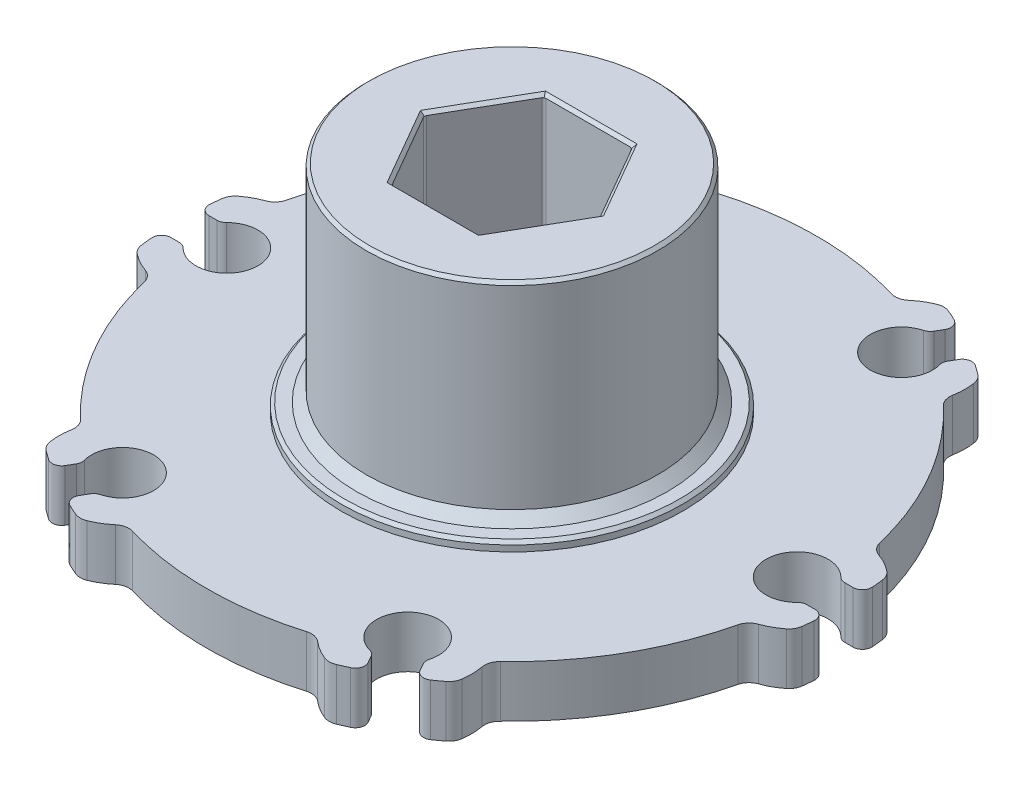
from build123d import *

# Parameters (mm, degrees)
SKETCH1_W           = 27.7876
SKETCH1_H           = 4.318
CUT_EXTRUDE1_DEPTH  = 40.534118828
CUT_EXTRUDE2_DEPTH  = 40.534118828
CUT_EXTRUDE3_DEPTH  = 40.534118828
CUT_EXTRUDE4_DEPTH  = 40.534118828
CUT_EXTRUDE5_DEPTH  = 40.534118828
CUT_EXTRUDE6_DEPTH  = 40.534118828
CUT_EXTRUDE7_DEPTH  = 40.534118828
CUT_EXTRUDE8_DEPTH  = 40.502232788
CUT_EXTRUDE9_DEPTH  = 40.502232788
CUT_EXTRUDE10_DEPTH = 40.502232788
CUT_EXTRUDE11_DEPTH = 39.097241392
CUT_EXTRUDE12_DEPTH = 39.097241392
SKETCH14_R          = 14.2748
BOSS_EXTRUDE1_DEPTH = 1.524
SKETCH15_R          = 9.23823544
BOSS_EXTRUDE2_DEPTH = 1.524
BOSS_EXTRUDE3_START = 0.762
SKETCH16_R          = 14.2748
BOSS_EXTRUDE3_DEPTH = 0.762
SKETCH17_R          = 12.1666
BOSS_EXTRUDE4_DEPTH = 17.272
CUT_EXTRUDE13_DEPTH = 46.584149412
SKETCH19_W          = 2.5908
SKETCH19_H          = 4.318
SKETCH20_W          = 2.5908
SKETCH20_H          = 4.318
SKETCH21_W          = 2.5908
SKETCH21_H          = 4.318
SKETCH22_W          = 2.5908
SKETCH22_H          = 4.318
SKETCH23_W          = 2.5908
SKETCH23_H          = 4.318
SKETCH24_W          = 2.5908
SKETCH24_H          = 4.318
CHAMFER1_SIZE       = 0.254
CHAMFER2_SIZE       = 0.8128
FILLET1_R           = 0.254
FILLET2_R           = 0.7874
FILLET3_R           = 1.27


with BuildPart() as part:
    # Sketch1 → Revolve1 (revolve)
    with BuildSketch(Plane.XY, mode=Mode.PRIVATE) as revolve1_sk:
        with Locations((13.8938, 5.207)):
            Rectangle(SKETCH1_W, SKETCH1_H)
    revolve(revolve1_sk.sketch.rotate(Axis((0, 7.366, 0), (0, -1, 0)), 270), axis=Axis((0, 7.366, 0), (0, -1, 0)))

    # Sketch2 → Cut-Extrude1 (cut, through all)
    with BuildSketch(Plane(origin=(0, 7.366, 0), x_dir=(-1, 0, 0), z_dir=(0, 1, 0))):
        with BuildLine():
            Line((27.742216161, 1.5875), (25.859959008, 1.5875))
            ThreePointArc((25.859959008, 1.5875), (26.4033, 0), (25.859959008, -1.5875))
            Line((25.859959008, -1.5875), (27.742216161, -1.5875))
            ThreePointArc((27.742216161, -1.5875), (27.7876, 0), (27.742216161, 1.5875))
        make_face()
    extrude(amount=-CUT_EXTRUDE1_DEPTH, mode=Mode.SUBTRACT)

    # Sketch3 → Cut-Extrude2 (cut, through all)
    with BuildSketch(Plane(origin=(0, 7.366, 0), x_dir=(-1, 0, 0), z_dir=(0, 1, 0))):
        with BuildLine():
            ThreePointArc((27.521980347, -3.832924674), (26.332306318, -4.701290474), (24.95050128, -5.211190755))
            ThreePointArc((24.95050128, -5.211190755), (22.074034915, -12.74445), (16.988274218, -19.002172568))
            ThreePointArc((16.988274218, -19.002172568), (17.23759014, -20.453800974), (17.080400312, -21.918271806))
            ThreePointArc((17.080400312, -21.918271806), (24.06476751, -13.8938), (27.521980347, -3.832924674))
        make_face()
    extrude(amount=-CUT_EXTRUDE2_DEPTH, mode=Mode.SUBTRACT)

    # Sketch4 → Cut-Extrude3 (cut, through all)
    with BuildSketch(Plane(origin=(0, 7.366, 0), x_dir=(-1, 0, 0), z_dir=(0, 1, 0))):
        with BuildLine():
            Line((15.245923409, -23.231713952), (14.304794833, -21.601631442))
            ThreePointArc((14.304794833, -21.601631442), (13.20165, -22.865928544), (11.555164176, -23.189131442))
            Line((11.555164176, -23.189131442), (12.496292752, -24.819213952))
            ThreePointArc((12.496292752, -24.819213952), (13.8938, -24.06476751), (15.245923409, -23.231713952))
        make_face()
    extrude(amount=-CUT_EXTRUDE3_DEPTH, mode=Mode.SUBTRACT)

    # Sketch5 → Cut-Extrude4 (cut, through all)
    with BuildSketch(Plane(origin=(0, 7.366, 0), x_dir=(-1, 0, 0), z_dir=(0, 1, 0))):
        with BuildLine():
            ThreePointArc((10.441580035, -25.75119648), (9.094716178, -25.155091448), (7.962227062, -24.213363323))
            ThreePointArc((7.962227062, -24.213363323), (0, -25.4889), (-7.962227062, -24.213363323))
            ThreePointArc((-7.962227062, -24.213363323), (-9.094716178, -25.155091448), (-10.441580035, -25.75119648))
            ThreePointArc((-10.441580035, -25.75119648), (0, -27.7876), (10.441580035, -25.75119648))
        make_face()
    extrude(amount=-CUT_EXTRUDE4_DEPTH, mode=Mode.SUBTRACT)

    # Sketch6 → Cut-Extrude5 (cut, through all)
    with BuildSketch(Plane(origin=(0, 7.366, 0), x_dir=(-1, 0, 0), z_dir=(0, 1, 0))):
        with BuildLine():
            Line((-12.496292752, -24.819213952), (-11.555164176, -23.189131442))
            ThreePointArc((-11.555164176, -23.189131442), (-13.20165, -22.865928544), (-14.304794833, -21.601631442))
            Line((-14.304794833, -21.601631442), (-15.245923409, -23.231713952))
            ThreePointArc((-15.245923409, -23.231713952), (-13.8938, -24.06476751), (-12.496292752, -24.819213952))
        make_face()
    extrude(amount=-CUT_EXTRUDE5_DEPTH, mode=Mode.SUBTRACT)

    # Sketch7 → Cut-Extrude6 (cut, through all)
    with BuildSketch(Plane(origin=(0, 7.366, 0), x_dir=(-1, 0, 0), z_dir=(0, 1, 0))):
        with BuildLine():
            ThreePointArc((-17.080400312, -21.918271806), (-17.23759014, -20.453800974), (-16.988274218, -19.002172568))
            ThreePointArc((-16.988274218, -19.002172568), (-22.074034915, -12.74445), (-24.95050128, -5.211190755))
            ThreePointArc((-24.95050128, -5.211190755), (-26.332306318, -4.701290474), (-27.521980347, -3.832924674))
            ThreePointArc((-27.521980347, -3.832924674), (-24.06476751, -13.8938), (-17.080400312, -21.918271806))
        make_face()
    extrude(amount=-CUT_EXTRUDE6_DEPTH, mode=Mode.SUBTRACT)

    # Sketch8 → Cut-Extrude7 (cut, through all)
    with BuildSketch(Plane(origin=(0, 7.366, 0), x_dir=(-1, 0, 0), z_dir=(0, 1, 0))):
        with BuildLine():
            Line((-27.742216161, -1.5875), (-25.859959008, -1.5875))
            ThreePointArc((-25.859959008, -1.5875), (-26.4033, 0), (-25.859959008, 1.5875))
            Line((-25.859959008, 1.5875), (-27.742216161, 1.5875))
            ThreePointArc((-27.742216161, 1.5875), (-27.7876, 0), (-27.742216161, -1.5875))
        make_face()
    extrude(amount=-CUT_EXTRUDE7_DEPTH, mode=Mode.SUBTRACT)

    # Sketch9 → Cut-Extrude8 (cut, through all)
    with BuildSketch(Plane(origin=(0, 7.366, 0), x_dir=(-1, 0, 0), z_dir=(0, 1, 0))):
        with BuildLine():
            ThreePointArc((-27.521980347, 3.832924674), (-26.332306318, 4.701290474), (-24.95050128, 5.211190755))
            ThreePointArc((-24.95050128, 5.211190755), (-22.074034915, 12.74445), (-16.988274218, 19.002172568))
            ThreePointArc((-16.988274218, 19.002172568), (-17.23759014, 20.453800974), (-17.080400312, 21.918271806))
            ThreePointArc((-17.080400312, 21.918271806), (-24.06476751, 13.8938), (-27.521980347, 3.832924674))
        make_face()
    extrude(amount=-CUT_EXTRUDE8_DEPTH, mode=Mode.SUBTRACT)

    # Sketch10 → Cut-Extrude9 (cut, through all)
    with BuildSketch(Plane(origin=(0, 7.366, 0), x_dir=(-1, 0, 0), z_dir=(0, 1, 0))):
        with BuildLine():
            Line((-15.245923409, 23.231713952), (-14.304794833, 21.601631442))
            ThreePointArc((-14.304794833, 21.601631442), (-13.20165, 22.865928544), (-11.555164176, 23.189131442))
            Line((-11.555164176, 23.189131442), (-12.496292752, 24.819213952))
            ThreePointArc((-12.496292752, 24.819213952), (-13.8938, 24.06476751), (-15.245923409, 23.231713952))
        make_face()
    extrude(amount=-CUT_EXTRUDE9_DEPTH, mode=Mode.SUBTRACT)

    # Sketch11 → Cut-Extrude10 (cut, through all)
    with BuildSketch(Plane(origin=(0, 7.366, 0), x_dir=(-1, 0, 0), z_dir=(0, 1, 0))):
        with BuildLine():
            ThreePointArc((-10.441580035, 25.75119648), (-9.094716178, 25.155091448), (-7.962227062, 24.213363323))
            ThreePointArc((-7.962227062, 24.213363323), (0, 25.4889), (7.962227062, 24.213363323))
            ThreePointArc((7.962227062, 24.213363323), (9.094716178, 25.155091448), (10.441580035, 25.75119648))
            ThreePointArc((10.441580035, 25.75119648), (0, 27.7876), (-10.441580035, 25.75119648))
        make_face()
    extrude(amount=-CUT_EXTRUDE10_DEPTH, mode=Mode.SUBTRACT)

    # Sketch12 → Cut-Extrude11 (cut, through all)
    with BuildSketch(Plane(origin=(0, 7.366, 0), x_dir=(-1, 0, 0), z_dir=(0, 1, 0))):
        with BuildLine():
            Line((12.496292752, 24.819213952), (11.555164176, 23.189131442))
            ThreePointArc((11.555164176, 23.189131442), (13.20165, 22.865928544), (14.304794833, 21.601631442))
            Line((14.304794833, 21.601631442), (15.245923409, 23.231713952))
            ThreePointArc((15.245923409, 23.231713952), (13.8938, 24.06476751), (12.496292752, 24.819213952))
        make_face()
    extrude(amount=-CUT_EXTRUDE11_DEPTH, mode=Mode.SUBTRACT)

    # Sketch13 → Cut-Extrude12 (cut, through all)
    with BuildSketch(Plane(origin=(0, 7.366, 0), x_dir=(-1, 0, 0), z_dir=(0, 1, 0))):
        with BuildLine():
            ThreePointArc((17.080400312, 21.918271806), (17.23759014, 20.453800974), (16.988274218, 19.002172568))
            ThreePointArc((16.988274218, 19.002172568), (22.074034915, 12.74445), (24.95050128, 5.211190755))
            ThreePointArc((24.95050128, 5.211190755), (26.332306318, 4.701290474), (27.521980347, 3.832924674))
            ThreePointArc((27.521980347, 3.832924674), (24.06476751, 13.8938), (17.080400312, 21.918271806))
        make_face()
    extrude(amount=-CUT_EXTRUDE12_DEPTH, mode=Mode.SUBTRACT)

    # Sketch14 → Boss-Extrude1 (add)
    with BuildSketch(Plane.XZ.offset(-3.048)):
        with Locations(Location((0, 0, 0), (0, 0, 270))):
            Circle(SKETCH14_R)
    extrude(amount=BOSS_EXTRUDE1_DEPTH)

    # Sketch15 → Boss-Extrude2 (add)
    with BuildSketch(Plane.XZ.offset(-1.524)):
        with Locations(Location((0, 0, 0), (0, 0, 270))):
            Circle(SKETCH15_R)
    extrude(amount=BOSS_EXTRUDE2_DEPTH)

    # Sketch16 → Boss-Extrude3 (add)
    with BuildSketch(Plane(origin=(0, 7.366, 0), x_dir=(-1, 0, 0), z_dir=(0, 1, 0)).offset(BOSS_EXTRUDE3_START)):
        with Locations(Location((0, 0, 0), (0, 0, 270))):
            Circle(SKETCH16_R)
    extrude(amount=-BOSS_EXTRUDE3_DEPTH)

    # Sketch17 → Boss-Extrude4 (add)
    with BuildSketch(Plane(origin=(0, 8.128, 0), x_dir=(-1, 0, 0), z_dir=(0, 1, 0))):
        with Locations(Location((0, 0, 0), (0, 0, 90))):
            Circle(SKETCH17_R)
    extrude(amount=BOSS_EXTRUDE4_DEPTH)

    # Sketch18 → Cut-Extrude13 (cut, through all)
    with BuildSketch(Plane(origin=(0, 25.4, 0), x_dir=(-1, 0, 0), z_dir=(0, 1, 0))):
        Polygon((-3.673506558, -6.3627), (3.673506558, -6.3627), (7.347013116, 0), (3.673506558, 6.3627), (-3.673506558, 6.3627), (-7.347013116, 0), align=None)
    extrude(amount=-CUT_EXTRUDE13_DEPTH, mode=Mode.SUBTRACT)

    # Sketch19 → Cut-Revolve1 (revolve, cut)
    with BuildSketch(Plane(origin=(0, 0, 0), x_dir=(-1, 0, 0), z_dir=(0, 0, -1))):
        with Locations((22.5171, 5.207)):
            Rectangle(SKETCH19_W, SKETCH19_H)
    revolve(axis=Axis((-23.8125, 3.048, 0), (0, 1, 0)), mode=Mode.SUBTRACT)

    # Sketch20 → Cut-Revolve2 (revolve, cut)
    with BuildSketch(Plane(origin=(0, 0, -20.622229928), x_dir=(-1, 0, 0), z_dir=(0, 0, -1))):
        with Locations((10.61085, 5.207)):
            Rectangle(SKETCH20_W, SKETCH20_H)
    revolve(axis=Axis((-11.90625, 3.048, -20.622229928), (0, 1, 0)), mode=Mode.SUBTRACT)

    # Sketch21 → Cut-Revolve3 (revolve, cut)
    with BuildSketch(Plane(origin=(0, 0, -20.622229928), x_dir=(-1, 0, 0), z_dir=(0, 0, -1))):
        with Locations((-13.20165, 5.207)):
            Rectangle(SKETCH21_W, SKETCH21_H)
    revolve(axis=Axis((11.90625, 3.048, -20.622229928), (0, 1, 0)), mode=Mode.SUBTRACT)

    # Sketch22 → Cut-Revolve4 (revolve, cut)
    with BuildSketch(Plane(origin=(0, 0, 0), x_dir=(-1, 0, 0), z_dir=(0, 0, -1))):
        with Locations((-25.1079, 5.207)):
            Rectangle(SKETCH22_W, SKETCH22_H)
    revolve(axis=Axis((23.8125, 3.048, 0), (0, 1, 0)), mode=Mode.SUBTRACT)

    # Sketch23 → Cut-Revolve5 (revolve, cut)
    with BuildSketch(Plane(origin=(0, 0, 20.622229928), x_dir=(-1, 0, 0), z_dir=(0, 0, -1))):
        with Locations((-13.20165, 5.207)):
            Rectangle(SKETCH23_W, SKETCH23_H)
    revolve(axis=Axis((11.90625, 3.048, 20.622229928), (0, 1, 0)), mode=Mode.SUBTRACT)

    # Sketch24 → Cut-Revolve6 (revolve, cut)
    with BuildSketch(Plane(origin=(0, 0, 20.622229928), x_dir=(-1, 0, 0), z_dir=(0, 0, -1))):
        with Locations((10.61085, 5.207)):
            Rectangle(SKETCH24_W, SKETCH24_H)
    revolve(axis=Axis((-11.90625, 3.048, 20.622229928), (0, 1, 0)), mode=Mode.SUBTRACT)

    # Chamfer1
    chamfer1_edges = [part.edges().sort_by_distance(p)[0] for p in [
        (0, 1.524, 14.2748),
        (0, 0, 9.23823544),
        (0, 8.128, 14.2748),
        (0, 25.4, -12.1666),
        (5.510259837, 0, -3.18135),
        (5.510259837, 0, 3.18135),
        (0, 0, 6.3627),
        (-5.510259837, 0, 3.18135),
        (-5.510259837, 0, -3.18135),
        (0, 0, -6.3627),
        (5.510259837, 25.4, -3.18135),
        (0, 25.4, -6.3627),
        (-5.510259837, 25.4, -3.18135),
        (-5.510259837, 25.4, 3.18135),
        (0, 25.4, 6.3627),
        (5.510259837, 25.4, 3.18135),
    ]]
    chamfer(chamfer1_edges, length=CHAMFER1_SIZE)

    # Chamfer2
    chamfer2_edges = [part.edges().sort_by_distance(p)[0] for p in [
        (0, 8.128, -12.1666),
    ]]
    chamfer(chamfer2_edges, length=CHAMFER2_SIZE)

    # Fillet1
    fillet1_edges = [part.edges().sort_by_distance(p)[0] for p in [
        (3.673506558, 12.7, -6.3627),
        (7.347013116, 12.7, 0),
        (-3.673506558, 12.7, -6.3627),
        (-7.347013116, 12.7, 0),
        (-3.673506558, 12.7, 6.3627),
        (3.673506558, 12.7, 6.3627),
    ]]
    fillet(fillet1_edges, radius=FILLET1_R)

    # Fillet2
    fillet2_edges = [part.edges().sort_by_distance(p)[0] for p in [
        (27.742216161, 5.207, -1.5875),
        (27.742216161, 5.207, 1.5875),
        (25.859959008, 5.207, 1.5875),
        (25.859959008, 5.207, -1.5875),
        (-27.742216161, 5.207, 1.5875),
        (-27.742216161, 5.207, -1.5875),
        (-25.859959008, 5.207, -1.5875),
        (-25.859959008, 5.207, 1.5875),
        (15.245923409, 5.207, 23.231713952),
        (12.496292752, 5.207, 24.819213952),
        (11.555164176, 5.207, 23.189131442),
        (14.304794833, 5.207, 21.601631442),
        (-12.496292752, 5.207, 24.819213952),
        (-15.245923409, 5.207, 23.231713952),
        (-14.304794833, 5.207, 21.601631442),
        (-11.555164176, 5.207, 23.189131442),
        (-15.245923409, 5.207, -23.231713952),
        (-12.496292752, 5.207, -24.819213952),
        (-11.555164176, 5.207, -23.189131442),
        (-14.304794833, 5.207, -21.601631442),
        (12.496292752, 5.207, -24.819213952),
        (15.245923409, 5.207, -23.231713952),
        (14.304794833, 5.207, -21.601631442),
        (11.555164176, 5.207, -23.189131442),
    ]]
    fillet(fillet2_edges, radius=FILLET2_R)

    # Fillet3
    fillet3_edges = [part.edges().sort_by_distance(p)[0] for p in [
        (27.521980347, 5.207, 3.832924674),
        (17.080400312, 5.207, 21.918271806),
        (16.988274218, 5.207, 19.002172568),
        (24.95050128, 5.207, 5.211190755),
        (10.441580035, 5.207, 25.75119648),
        (-10.441580035, 5.207, 25.75119648),
        (-7.962227062, 5.207, 24.213363323),
        (7.962227062, 5.207, 24.213363323),
        (-17.080400312, 5.207, 21.918271806),
        (-27.521980347, 5.207, 3.832924674),
        (-24.95050128, 5.207, 5.211190755),
        (-16.988274218, 5.207, 19.002172568),
        (-27.521980347, 5.207, -3.832924674),
        (-17.080400312, 5.207, -21.918271806),
        (-16.988274218, 5.207, -19.002172568),
        (-24.95050128, 5.207, -5.211190755),
        (-10.441580035, 5.207, -25.75119648),
        (10.441580035, 5.207, -25.75119648),
        (7.962227062, 5.207, -24.213363323),
        (-7.962227062, 5.207, -24.213363323),
        (17.080400312, 5.207, -21.918271806),
        (27.521980347, 5.207, -3.832924674),
        (24.95050128, 5.207, -5.211190755),
        (16.988274218, 5.207, -19.002172568),
    ]]
    fillet(fillet3_edges, radius=FILLET3_R)


solid = part.part
